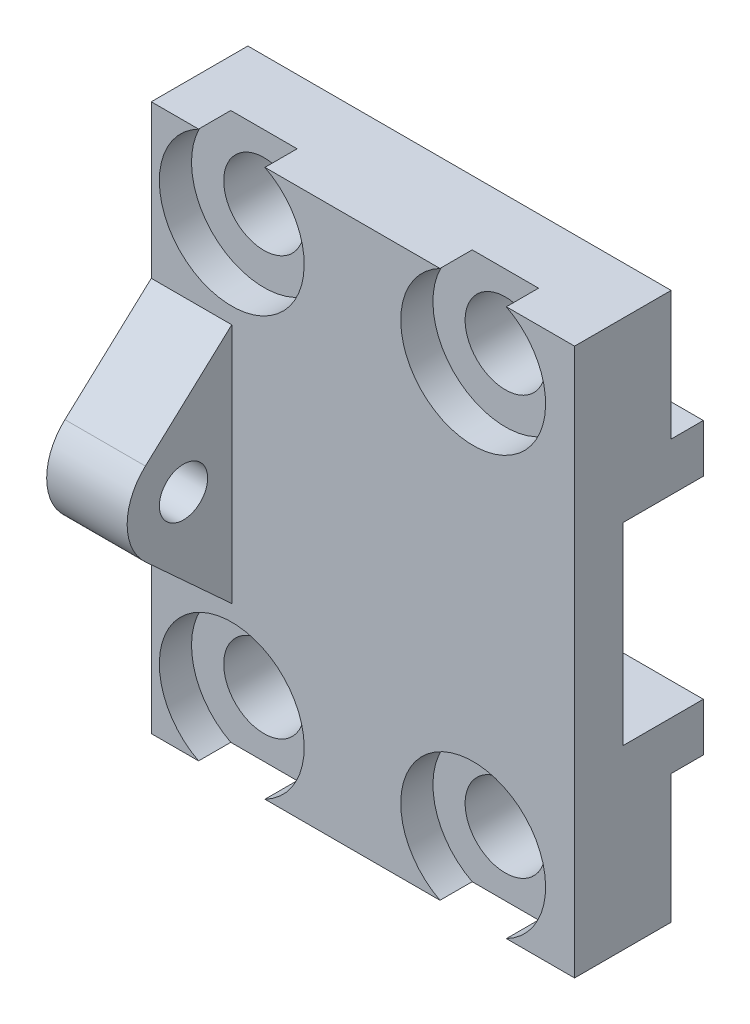
from build123d import *

# Parameters (mm, degrees)
SKETCH_1_W          = 24.3
SKETCH_1_H          = 3
EXTRUDE_1_DEPTH     = 5
EXTRUDE_1_2_DEPTH   = 5
SKETCH_2_W          = 24.3
SKETCH_2_H          = 18
EXTRUDE_2_DEPTH     = 3
EXTRUDE_3_DEPTH     = 2
SKETCH_5_W          = 26.3
SKETCH_5_H          = 8
SKETCH_5_R          = 2.5
EXTRUDE_5_DEPTH     = 6
EXTRUDE_6_DEPTH     = 5
SKETCH_7_R          = 4.5
CUT_EXTRUDE_1_DEPTH = 2


with BuildPart() as part:
    # Эскиз1 → Бобышка-Вытянуть1 (new body)
    with BuildSketch(Plane.XY):
        with Locations((0, 7.5)):
            Rectangle(SKETCH_1_W, SKETCH_1_H)
    extrude(amount=EXTRUDE_1_DEPTH)



with BuildPart() as body_2:
    # Эскиз1 → Extrude 1 2 (new body)
    with BuildSketch(Plane.XY):
        with Locations((0, -7.5)):
            Rectangle(SKETCH_1_W, SKETCH_1_H)
    extrude(amount=EXTRUDE_1_2_DEPTH)


with BuildPart() as part_1:
    add(part.part)

    add(body_2.part)  # Бобышка-Вытянуть2 merges body 2
    # Эскиз2 → Бобышка-Вытянуть2 (add)
    with BuildSketch(Plane.XY.offset(5)):
        Rectangle(SKETCH_2_W, SKETCH_2_H)
    extrude(amount=EXTRUDE_2_DEPTH)



with BuildPart() as body_2_2:
    # Эскиз3 → Бобышка-Вытянуть3 (new body)
    with BuildSketch(Plane.ZY.offset(12.15)):
        Polygon((0, -9), (0, -6), (3, -6), (5, -4), (5, 4), (3, 6), (0, 6), (0, 9), (8, 9), (8, -9), align=None)
    extrude(amount=EXTRUDE_3_DEPTH)


with BuildPart() as part_2:
    add(part_1.part)

    add(body_2_2.part)  # Бобышка-Вытянуть5 merges body 2 2
    # Эскиз5 → Бобышка-Вытянуть5 (add)
    # profile 1 of 2: a face of its own
    with BuildSketch(Plane.XY.offset(8)):
        with Locations((-1, -13)):
            Rectangle(SKETCH_5_W, SKETCH_5_H)
        with Locations((-9.15, -13)):
            Circle(SKETCH_5_R, mode=Mode.SUBTRACT)
        with Locations((5.85, -13)):
            Circle(SKETCH_5_R, mode=Mode.SUBTRACT)
    # profile 2 of 2: a face of its own
    with BuildSketch(Plane.XY.offset(8)):
        with Locations((-1, 13)):
            Rectangle(SKETCH_5_W, SKETCH_5_H)
        with Locations((5.85, 13)):
            Circle(SKETCH_5_R, mode=Mode.SUBTRACT)
        with Locations((-9.15, 13)):
            Circle(SKETCH_5_R, mode=Mode.SUBTRACT)
    extrude(amount=-EXTRUDE_5_DEPTH)

    # Эскиз7 → Вырез-Вытянуть1 (cut)
    with BuildSketch(Plane.XY.offset(8)):
        with Locations((5.85, 13)):
            Circle(SKETCH_7_R)
        with Locations((5.85, -13)):
            Circle(SKETCH_7_R)
        with Locations((-9.15, -13)):
            Circle(SKETCH_7_R)
        with Locations((-9.15, 13)):
            Circle(SKETCH_7_R)
    extrude(amount=-CUT_EXTRUDE_1_DEPTH, mode=Mode.SUBTRACT)


with BuildPart() as body_2_3:
    # Эскиз6 → Бобышка-Вытянуть6 (new body)
    with BuildSketch(Plane.ZY.offset(14.15)):
        with BuildLine():
            Line((8, -7.5), (13.36556145, -2.579557913))
            ThreePointArc((13.36556145, -2.579557913), (10.498526427, -3.463888603), (8, -1.802775638))
            Line((8, -1.802775638), (8, -7.5))
        make_face()
        with BuildLine():
            ThreePointArc((8, 1.802775638), (10.498526427, 3.463888603), (13.36556145, 2.579557913))
            Line((13.36556145, 2.579557913), (8, 7.5))
            Line((8, 7.5), (8, 1.802775638))
        make_face()
        with BuildLine():
            ThreePointArc((14.5, 0), (14.203862128, 1.408995196), (13.36556145, 2.579557913))
            ThreePointArc((13.36556145, 2.579557913), (10.498526427, 3.463888603), (8, 1.802775638))
            Line((8, 1.802775638), (8, 0))
            Line((8, 0), (9.5, 0))
            ThreePointArc((9.5, 0), (11, 1.5), (12.5, 0))
            Line((12.5, 0), (14.5, 0))
        make_face()
        with BuildLine():
            ThreePointArc((13.36556145, -2.579557913), (14.203862128, -1.408995196), (14.5, 0))
            Line((14.5, 0), (12.5, 0))
            ThreePointArc((12.5, 0), (11, -1.5), (9.5, 0))
            Line((9.5, 0), (8, 0))
            Line((8, 0), (8, -1.802775638))
            ThreePointArc((8, -1.802775638), (10.498526427, -3.463888603), (13.36556145, -2.579557913))
        make_face()
    extrude(amount=-EXTRUDE_6_DEPTH)


solid = Compound([part_2.part, body_2_3.part])
